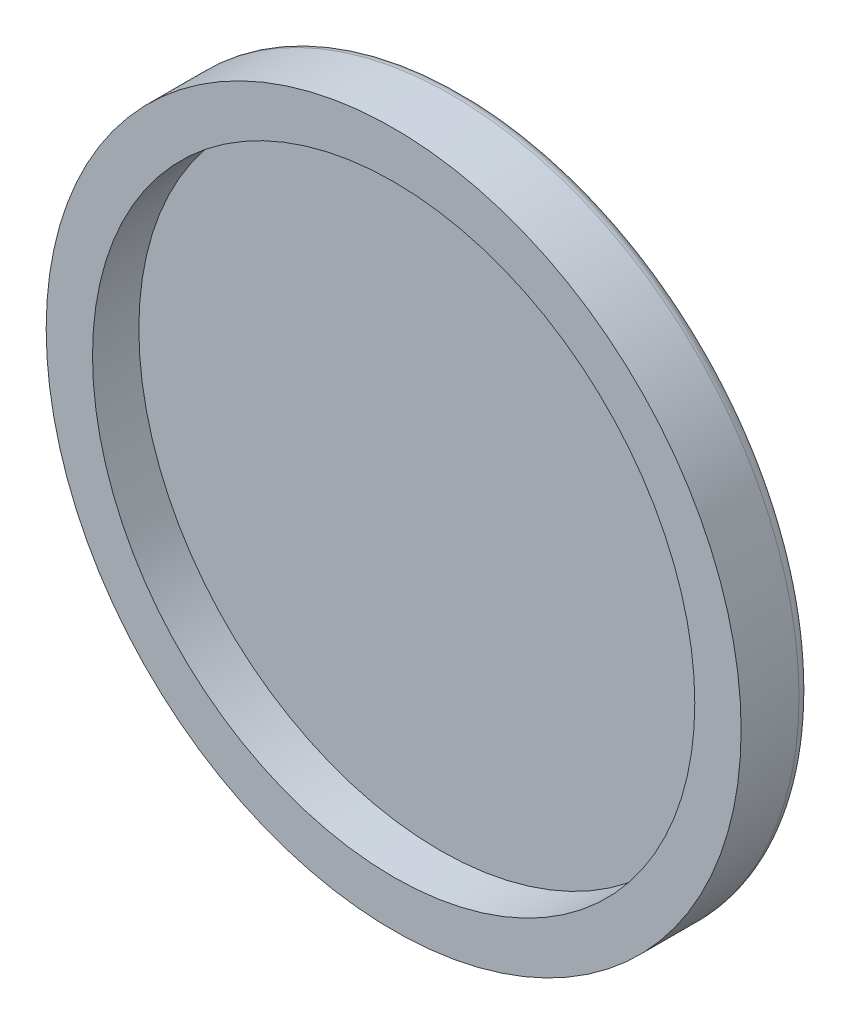
from build123d import *

# Parameters (mm, degrees)
SKETCH1_R           = 15
SKETCH1_R_2         = 13
BOSS_EXTRUDE1_DEPTH = 2
BOSS_EXTRUDE2_START = 1
SKETCH2_R           = 15
BOSS_EXTRUDE2_DEPTH = 1
FILLET1_R           = 0.5


with BuildPart() as part:
    # Sketch1 → Boss-Extrude1 (new body)
    with BuildSketch(Plane.XY):
        Circle(SKETCH1_R)
        Circle(SKETCH1_R_2, mode=Mode.SUBTRACT)
    extrude(amount=BOSS_EXTRUDE1_DEPTH)

    # Sketch2 → Boss-Extrude2 (add)
    with BuildSketch(Plane(origin=(0, 0, 0), x_dir=(-1, 0, 0), z_dir=(0, 0, -1)).offset(BOSS_EXTRUDE2_START)):
        Circle(SKETCH2_R)
    extrude(amount=-BOSS_EXTRUDE2_DEPTH)

    # Fillet1
    fillet1_edges = [part.edges().sort_by_distance(p)[0] for p in [
        (15, 0, -1),
    ]]
    fillet(fillet1_edges, radius=FILLET1_R)


solid = part.part
